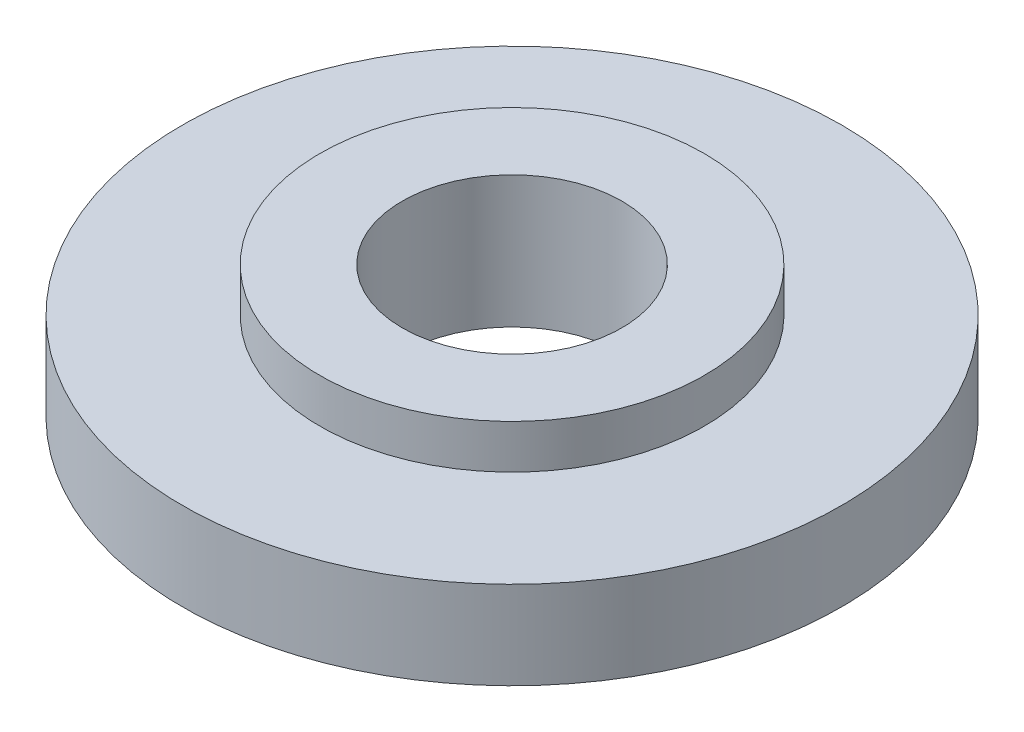
from build123d import *


with BuildPart() as part:
    # 草图1 → 旋转1 (revolve)
    with BuildSketch(Plane.XY, mode=Mode.PRIVATE) as revolve_1_sk:
        Polygon((20, 0), (60, 0), (60, 16), (35, 16), (35, 24), (20, 24), align=None)
    revolve(revolve_1_sk.sketch.rotate(Axis((0, -10, 0), (0, 1, 0)), 90), axis=Axis((0, -10, 0), (0, 1, 0)))


solid = part.part
